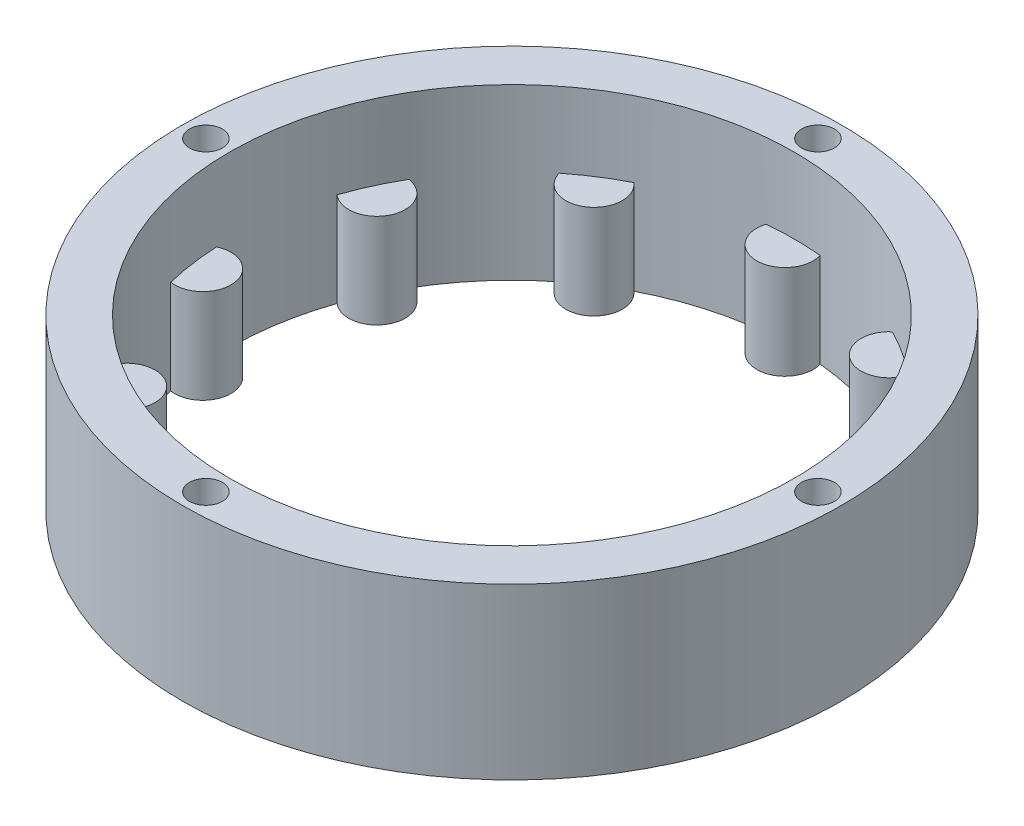
from build123d import *

# Parameters (mm, degrees)
SKETCH1_R           = 35
SKETCH1_R_2         = 30
BOSS_EXTRUDE1_DEPTH = 18
SKETCH2_R           = 3
BOSS_EXTRUDE2_DEPTH = 10
SKETCH3_R           = 1.75
CUT_EXTRUDE1_DEPTH  = 53.668776329


with BuildPart() as part:
    # Sketch1 → Boss-Extrude1 (new body)
    with BuildSketch(Plane(origin=(0, 0, 0), x_dir=(1, 0, 0), z_dir=(0, 1, 0))):
        with Locations(Location((0, 0, 0), (0, 0, 270))):
            Circle(SKETCH1_R)
        with Locations(Location((0, 0, 0), (0, 0, 270))):
            Circle(SKETCH1_R_2, mode=Mode.SUBTRACT)
    extrude(amount=BOSS_EXTRUDE1_DEPTH)

    # Sketch2 → Boss-Extrude2 (add)
    with BuildSketch(Plane(origin=(0, 0, 0), x_dir=(1, 0, 0), z_dir=(0, 1, 0))):
        with Locations((0, 29)):
            Circle(SKETCH2_R)
        with Locations((15.678583706, 24.396352452)):
            Circle(SKETCH2_R)
        with Locations((26.379327865, 12.047035377)):
            Circle(SKETCH2_R)
        with Locations((28.704821815, -4.12713031)):
            Circle(SKETCH2_R)
        with Locations((21.916737656, -18.990961284)):
            Circle(SKETCH2_R)
        with Locations((8.170244148, -27.825296235)):
            Circle(SKETCH2_R)
        with Locations((-8.170244148, -27.825296235)):
            Circle(SKETCH2_R)
        with Locations((-21.916737656, -18.990961284)):
            Circle(SKETCH2_R)
        with Locations((-28.704821815, -4.12713031)):
            Circle(SKETCH2_R)
        with Locations((-26.379327865, 12.047035377)):
            Circle(SKETCH2_R)
        with Locations((-15.678583706, 24.396352452)):
            Circle(SKETCH2_R)
    extrude(amount=BOSS_EXTRUDE2_DEPTH)

    # Sketch3 → Cut-Extrude1 (cut, through all)
    with BuildSketch(Plane(origin=(0, 18, 0), x_dir=(1, 0, 0), z_dir=(0, 1, 0))):
        with Locations(Location((0, 32.5, 0), (0, 0, 270))):
            Circle(SKETCH3_R)
        with Locations(Location((32.5, 0, 0), (0, 0, 270))):
            Circle(SKETCH3_R)
        with Locations(Location((0, -32.5, 0), (0, 0, 270))):
            Circle(SKETCH3_R)
        with Locations(Location((-32.5, 0, 0), (0, 0, 270))):
            Circle(SKETCH3_R)
    extrude(amount=-CUT_EXTRUDE1_DEPTH, mode=Mode.SUBTRACT)


solid = part.part
